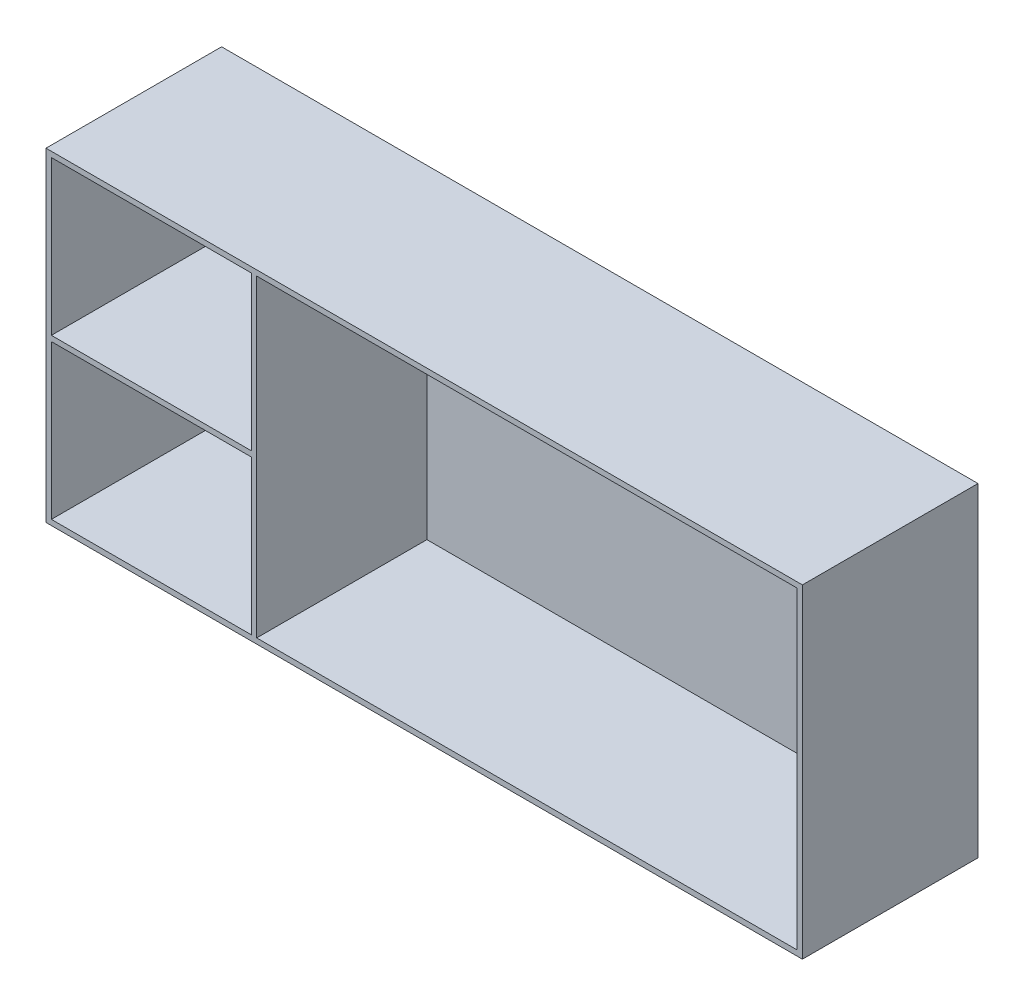
from build123d import *

# Parameters (mm, degrees)
SKICA1_W                 = 280
SKICA1_H                 = 120
P_IDAT_VYSUNUT_M1_DEPTH  = 65
SKICA2_W                 = 74
SKICA2_H                 = 57
SKICA2_W_2               = 200
SKICA2_H_2               = 116
ODEBRAT_VYSUNUT_M1_DEPTH = 63


with BuildPart() as part:
    # Skica1 → Přidat vysunutím1 (new body)
    with BuildSketch(Plane.XY):
        Rectangle(SKICA1_W, SKICA1_H)
    extrude(amount=P_IDAT_VYSUNUT_M1_DEPTH)

    # Skica2 → Odebrat vysunutím1 (cut)
    with BuildSketch(Plane.XY.offset(65)):
        with Locations((-101, -29.5)):
            Rectangle(SKICA2_W, SKICA2_H)
        with Locations((-101, 29.5)):
            Rectangle(SKICA2_W, SKICA2_H)
        with Locations((38, 0)):
            Rectangle(SKICA2_W_2, SKICA2_H_2)
    extrude(amount=-ODEBRAT_VYSUNUT_M1_DEPTH, mode=Mode.SUBTRACT)


solid = part.part
